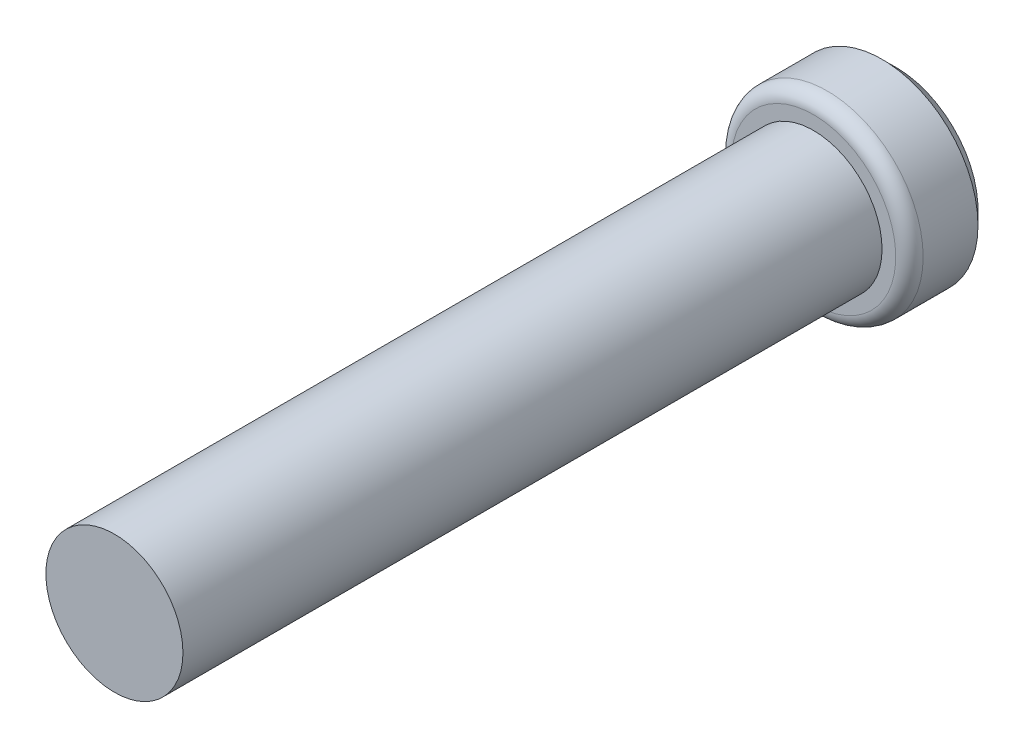
from build123d import *

# Parameters (mm, degrees)
SKETCH1_R           = 2.5
BOSS_EXTRUDE2_DEPTH = 25.5
SKETCH2_R           = 3.5
BOSS_EXTRUDE3_DEPTH = 3
CUT_EXTRUDE2_DEPTH  = 2
CHAMFER2_SIZE       = 0.5
FILLET5_R           = 0.5


with BuildPart() as part:
    # Sketch1 → Boss-Extrude2 (new body)
    with BuildSketch(Plane.XY):
        Circle(SKETCH1_R)
    extrude(amount=BOSS_EXTRUDE2_DEPTH)

    # Sketch2 → Boss-Extrude3 (add)
    with BuildSketch(Plane(origin=(0, 0, 0), x_dir=(-1, 0, 0), z_dir=(0, 0, -1))):
        Circle(SKETCH2_R)
    extrude(amount=BOSS_EXTRUDE3_DEPTH)

    # Sketch4 → Cut-Extrude2 (cut)
    with BuildSketch(Plane(origin=(0, 0, -3), x_dir=(-1, 0, 0), z_dir=(0, 0, -1))):
        Polygon((2.180058464, 0), (0, 0), (0, -2.517314682), (2.180058464, -1.258657341), align=None)
        Polygon((2.180058464, 1.258657341), (0, 2.517314682), (0, 0), (2.180058464, 0), align=None)
        Polygon((0, 0), (0, 2.517314682), (-2.180058464, 1.258657341), (-2.180058464, 0), align=None)
        Polygon((0, -2.517314682), (0, 0), (-2.180058464, 0), (-2.180058464, -1.258657341), align=None)
    extrude(amount=-CUT_EXTRUDE2_DEPTH, mode=Mode.SUBTRACT)

    # Chamfer2
    chamfer2_edges = [part.edges().sort_by_distance(p)[0] for p in [
        (3.5, 0, -3),
    ]]
    chamfer(chamfer2_edges, length=CHAMFER2_SIZE)

    # Fillet5
    fillet5_edges = [part.edges().sort_by_distance(p)[0] for p in [
        (3.5, 0, 0),
    ]]
    fillet(fillet5_edges, radius=FILLET5_R)


solid = part.part
